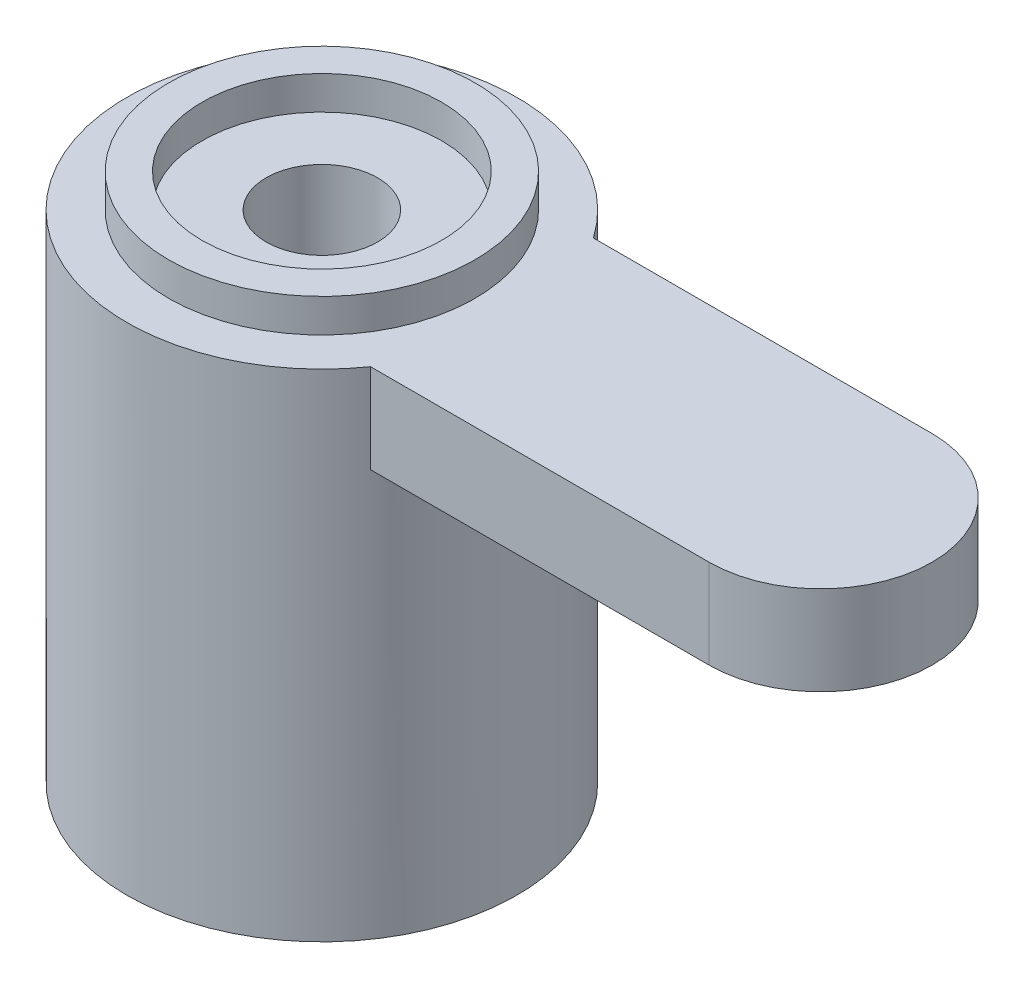
from build123d import *

# Parameters (mm, degrees)
SZKIC1_R                    = 3.5
DODANIE_WYCI_GNI_CIE1_DEPTH = 9.5
SZKIC2_R                    = 1.9
WYTNIJ_WYCI_GNI_CIE1_DEPTH  = 3.5
SZKIC3_R                    = 2
DODANIE_WYCI_GNI_CIE2_DEPTH = 1.6
WYTNIJ_WYCI_GNI_CIE2_START  = -0.6
SZKIC4_R                    = 2.15
WYTNIJ_WYCI_GNI_CIE2_DEPTH  = 0.6
SZKIC5_R                    = 1
WYTNIJ_WYCI_GNI_CIE3_DEPTH  = 31.6
WYTNIJ_WYCI_GNI_CIE4_START  = -0.6
SZKIC6_R                    = 3.5
SZKIC6_R_2                  = 2.75
WYTNIJ_WYCI_GNI_CIE4_DEPTH  = 0.6
WYTNIJ_WYCI_GNI_CIE5_DEPTH  = 10


with BuildPart() as part:
    # Szkic1 → Dodanie-wyciągnięcie1 (new body)
    with BuildSketch(Plane(origin=(0, 0, 0), x_dir=(1, 0, 0), z_dir=(0, 1, 0))):
        with Locations(Location((0, 0, 0), (0, 0, 270))):
            Circle(SZKIC1_R)
    extrude(amount=DODANIE_WYCI_GNI_CIE1_DEPTH)

    # Szkic2 → Wytnij-wyciągnięcie1 (cut)
    with BuildSketch(Plane.XZ):
        with Locations(Location((0, 0, 0), (0, 0, 270))):
            Circle(SZKIC2_R)
    extrude(amount=-WYTNIJ_WYCI_GNI_CIE1_DEPTH, mode=Mode.SUBTRACT)

    # Szkic3 → Dodanie-wyciągnięcie2 (add)
    with BuildSketch(Plane(origin=(0, 8.9, 0), x_dir=(1, 0, 0), z_dir=(0, 1, 0))):
        with Locations((-8.95, 0)):
            Circle(SZKIC3_R)
        with BuildLine():
            Line((-2, 2), (-8.95, 2))
            ThreePointArc((-8.95, 2), (-7.535786438, 1.414213562), (-6.95, 0))
            ThreePointArc((-6.95, 0), (-7.535786438, -1.414213562), (-8.95, -2))
            Line((-8.95, -2), (-2, -2))
            Line((-2, -2), (-2, 2))
        make_face()
        with Locations((0, 7)):
            Circle(SZKIC3_R)
        with BuildLine():
            Line((-2, 7), (-2, 2))
            Line((-2, 2), (0, 2))
            Line((0, 2), (2, 2))
            Line((2, 2), (2, 7))
            ThreePointArc((2, 7), (0, 5), (-2, 7))
        make_face()
        with BuildLine():
            Line((8.95, 2), (2, 2))
            Line((2, 2), (2, 0))
            Line((2, 0), (2, -2))
            Line((2, -2), (8.95, -2))
            ThreePointArc((8.95, -2), (6.95, 0), (8.95, 2))
        make_face()
        with Locations((8.95, 0)):
            Circle(SZKIC3_R)
        with Locations((0, -7)):
            Circle(SZKIC3_R)
        with BuildLine():
            Line((2, -2), (-2, -2))
            Line((-2, -2), (-2, -7))
            ThreePointArc((-2, -7), (0, -5), (2, -7))
            Line((2, -7), (2, -2))
        make_face()
    extrude(amount=-DODANIE_WYCI_GNI_CIE2_DEPTH)

    # Szkic4 → Wytnij-wyciągnięcie2 (cut)
    with BuildSketch(Plane(origin=(0, 9.5, 0), x_dir=(1, 0, 0), z_dir=(0, 1, 0)).offset(WYTNIJ_WYCI_GNI_CIE2_START)):
        with Locations(Location((0, 0, 0), (0, 0, 270))):
            Circle(SZKIC4_R)
    extrude(amount=WYTNIJ_WYCI_GNI_CIE2_DEPTH, mode=Mode.SUBTRACT)

    # Szkic5 → Wytnij-wyciągnięcie3 (cut)
    with BuildSketch(Plane(origin=(0, 8.9, 0), x_dir=(1, 0, 0), z_dir=(0, 1, 0))):
        with Locations(Location((0, 0, 0), (0, 0, 270))):
            Circle(SZKIC5_R)
    extrude(amount=-WYTNIJ_WYCI_GNI_CIE3_DEPTH, mode=Mode.SUBTRACT)

    # Szkic6 → Wytnij-wyciągnięcie4 (cut)
    with BuildSketch(Plane(origin=(0, 9.5, 0), x_dir=(1, 0, 0), z_dir=(0, 1, 0)).offset(WYTNIJ_WYCI_GNI_CIE4_START)):
        with Locations(Location((0, 0, 0), (0, 0, 124.849904579))):
            Circle(SZKIC6_R)
        with Locations(Location((0, 0, 0), (0, 0, 270))):
            Circle(SZKIC6_R_2, mode=Mode.SUBTRACT)
    extrude(amount=WYTNIJ_WYCI_GNI_CIE4_DEPTH, mode=Mode.SUBTRACT)

    # Szkic7 → Wytnij-wyciągnięcie5 (cut)
    with BuildSketch(Plane.XZ.offset(-7.3)):
        with BuildLine():
            ThreePointArc((-2, -7), (0, -9), (2, -7))
            Line((2, -7), (2, -2.872281323))
            ThreePointArc((2, -2.872281323), (0, -3.5), (-2, -2.872281323))
            Line((-2, -2.872281323), (-2, -7))
        make_face()
        with BuildLine():
            Line((2, -11.805294156), (2, -7))
            ThreePointArc((2, -7), (0, -9), (-2, -7))
            Line((-2, -7), (-2, -2.872281323))
            ThreePointArc((-2, -2.872281323), (-2.872281323, 2), (2, 2.872281323))
            Line((2, 2.872281323), (2, 7))
            Line((2, 7), (2, 11.668395205))
            Line((2, 11.668395205), (-21.006020829, 11.668395205))
            Line((-21.006020829, 11.668395205), (-21.006020829, -11.805294156))
            Line((-21.006020829, -11.805294156), (2, -11.805294156))
        make_face()
    extrude(amount=-WYTNIJ_WYCI_GNI_CIE5_DEPTH, mode=Mode.SUBTRACT)


solid = part.part
